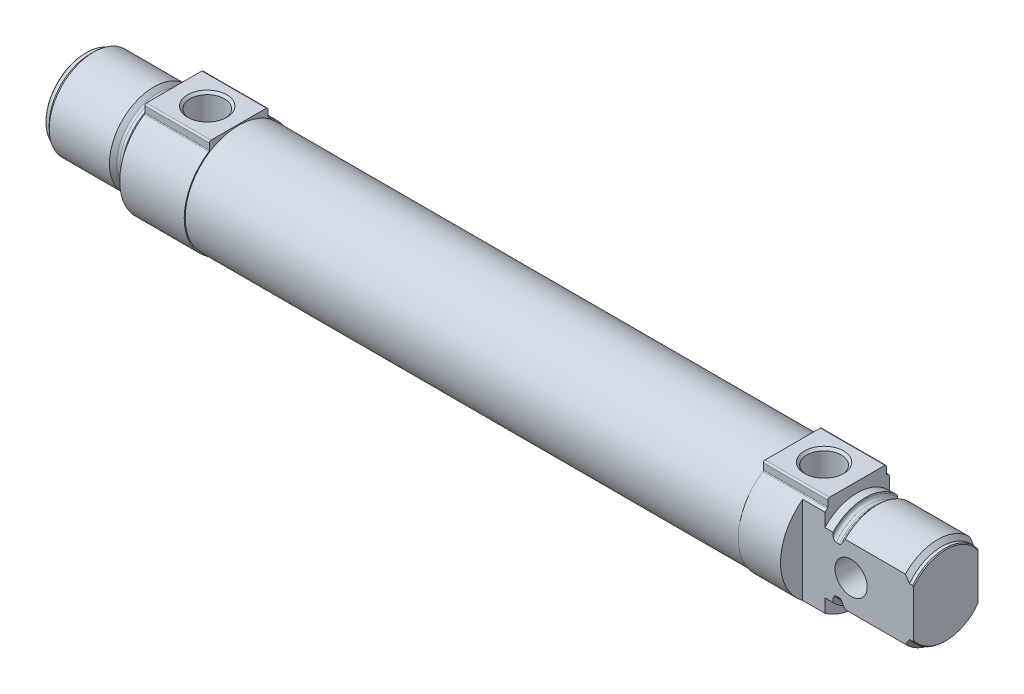
from build123d import *

# Parameters (mm, degrees)
AUFSATZ_LINEAR_AUSTRAGEN1_DEPTH      = 16
SKIZZE3_W                            = 137.5
SKIZZE3_H                            = 13.25
AUFSATZ_LINEAR_AUSTRAGEN2_DEPTH      = 16
SCHNITT_LINEAR_AUSTRAGEN1_DEPTH      = 13.5
SCHNITT_LINEAR_AUSTRAGEN1_DEPTH_BACK = 13.5
BOHRUNG1_D                           = 8
BOHRUNG2_D                           = 8.566
BOHRUNG2_DEPTH                       = 13.5
BOHRUNG2_CSINK_D                     = 9.728
BOHRUNG2_CSINK_ANGLE                 = 90
BOHRUNG3_D                           = 8.566
BOHRUNG3_DEPTH                       = 16
BOHRUNG3_CSINK_D                     = 9.728
BOHRUNG3_CSINK_ANGLE                 = 90
BOHRUNG3_TIP                         = 2.472791203


with BuildPart() as part:
    # Skizze1 → Rotation1 (revolve)
    with BuildSketch(Plane.XY):
        with BuildLine():
            Line((0, 0), (0, 9.8))
            Line((0, 9.8), (0.2, 10))
            Line((0.2, 10), (1, 10))
            Line((1, 10), (2, 11))
            Line((2, 11), (16.95, 11))
            Line((16.95, 11), (17.865685425, 10.084314575))
            ThreePointArc((17.865685425, 10.084314575), (18.125224104, 9.910896374), (18.43137085, 9.85))
            Line((18.43137085, 9.85), (19.2, 9.85))
            ThreePointArc((19.2, 9.85), (19.765685425, 10.084314575), (20, 10.65))
            Line((20, 10.65), (20, 11))
            Line((20, 11), (22, 11))
            Line((22, 11), (22, 0))
            Line((22, 0), (0, 0))
        make_face()
    revolve(axis=Axis((22, 0, 0), (-1, 0, 0)))

    # Skizze2 → Aufsatz-Linear austragen1 (add)
    with BuildSketch(Plane(origin=(22, 0, 0), x_dir=(0, 0, -1), z_dir=(1, 0, 0))):
        with BuildLine():
            Line((7.25, 11.551515052), (7.25, 13.1))
            ThreePointArc((7.25, 13.1), (7.132842712, 13.382842712), (6.85, 13.5))
            Line((6.85, 13.5), (-6.85, 13.5))
            ThreePointArc((-6.85, 13.5), (-7.132842712, 13.382842712), (-7.25, 13.1))
            Line((-7.25, 13.1), (-7.25, 11.551515052))
            ThreePointArc((-7.25, 11.551515052), (-7.286144803, 11.408754992), (-7.385869565, 11.30039516))
            ThreePointArc((-7.385869565, 11.30039516), (0, -13.5), (7.385869565, 11.30039516))
            ThreePointArc((7.385869565, 11.30039516), (7.286144803, 11.408754992), (7.25, 11.551515052))
        make_face()
    extrude(amount=AUFSATZ_LINEAR_AUSTRAGEN1_DEPTH)

    # Skizze3 → Rotation2 (revolve)
    with BuildSketch(Plane.XY):
        with Locations((106.75, 6.625)):
            Rectangle(SKIZZE3_W, SKIZZE3_H)
    revolve(axis=Axis((175.5, 0, 0), (-1, 0, 0)))

    # Skizze4 → Aufsatz-Linear austragen2 (add)
    with BuildSketch(Plane(origin=(175.5, 0, 0), x_dir=(0, 0, -1), z_dir=(1, 0, 0))):
        with BuildLine():
            Line((7.25, 11.551515052), (7.25, 13.1))
            ThreePointArc((7.25, 13.1), (7.132842712, 13.382842712), (6.85, 13.5))
            Line((6.85, 13.5), (-6.85, 13.5))
            ThreePointArc((-6.85, 13.5), (-7.132842712, 13.382842712), (-7.25, 13.1))
            Line((-7.25, 13.1), (-7.25, 11.551515052))
            ThreePointArc((-7.25, 11.551515052), (-7.286144803, 11.408754992), (-7.385869565, 11.30039516))
            ThreePointArc((-7.385869565, 11.30039516), (0, -13.5), (7.385869565, 11.30039516))
            ThreePointArc((7.385869565, 11.30039516), (7.286144803, 11.408754992), (7.25, 11.551515052))
        make_face()
    extrude(amount=AUFSATZ_LINEAR_AUSTRAGEN2_DEPTH)

    # Skizze5 → Rotation3 (revolve)
    with BuildSketch(Plane.XY):
        with BuildLine():
            Line((191.5, 0), (191.5, 11))
            Line((191.5, 11), (193.5, 11))
            Line((193.5, 11), (193.5, 10.65))
            ThreePointArc((193.5, 10.65), (193.734314575, 10.084314575), (194.3, 9.85))
            Line((194.3, 9.85), (195.06862915, 9.85))
            ThreePointArc((195.06862915, 9.85), (195.374775896, 9.910896374), (195.634314575, 10.084314575))
            Line((195.634314575, 10.084314575), (196.55, 11))
            Line((196.55, 11), (211.5, 11))
            Line((211.5, 11), (212.5, 10))
            Line((212.5, 10), (213.3, 10))
            Line((213.3, 10), (213.5, 9.8))
            Line((213.5, 9.8), (213.5, 0))
            Line((213.5, 0), (191.5, 0))
        make_face()
    revolve(axis=Axis((213.5, 0, 0), (-1, 0, 0)))

    # Skizze6 → Schnitt-Linear austragen1 (cut, two sides: drawn at the far end of the back side and taken through both)
    with BuildSketch(Plane(origin=(0, 0, 0), x_dir=(1, 0, 0), z_dir=(0, 1, 0)).offset(-SCHNITT_LINEAR_AUSTRAGEN1_DEPTH_BACK)):
        Polygon((186, 24), (186, 8), (213.5, 8), (213.5, -8), (186, -8), (186, -24), (229.5, -24), (229.5, 24), align=None)
    extrude(amount=SCHNITT_LINEAR_AUSTRAGEN1_DEPTH + SCHNITT_LINEAR_AUSTRAGEN1_DEPTH_BACK, mode=Mode.SUBTRACT)

    # Bohrung1 (through all)
    with Locations(Plane(origin=(0, 0, -8), x_dir=(-1, 0, 0), z_dir=(0, 0, -1))):
        with Locations((-198, 0)):
            Hole(BOHRUNG1_D / 2)

    # Bohrung2
    with Locations(Plane(origin=(0, 13.5, 0), x_dir=(1, 0, 0), z_dir=(0, 1, 0))):
        with Locations((30.2, 0)):
            CounterSinkHole(BOHRUNG2_D / 2, BOHRUNG2_CSINK_D / 2, depth=BOHRUNG2_DEPTH, counter_sink_angle=BOHRUNG2_CSINK_ANGLE)

    # Bohrung3
    with Locations(Plane(origin=(0, 13.5, 0), x_dir=(1, 0, 0), z_dir=(0, 1, 0))):
        with Locations((183.3, 0)):
            CounterSinkHole(BOHRUNG3_D / 2, BOHRUNG3_CSINK_D / 2, depth=BOHRUNG3_DEPTH, counter_sink_angle=BOHRUNG3_CSINK_ANGLE)
            with Locations((0, 0, -(BOHRUNG3_DEPTH + BOHRUNG3_TIP / 2))):  # 120° drill point
                Cone(0, BOHRUNG3_D / 2, BOHRUNG3_TIP, mode=Mode.SUBTRACT)

    # Skizze13 → Schnitt-Rotation1 (revolve, cut)
    with BuildSketch(Plane.XY):
        Polygon((-6, 0), (-6, 5), (52.6, 5), (52.6, 12.5), (158.85, 12.5), (158.85, 0), align=None)
    revolve(axis=Axis((158.85, 0, 0), (-1, 0, 0)), mode=Mode.SUBTRACT)


solid = part.part
